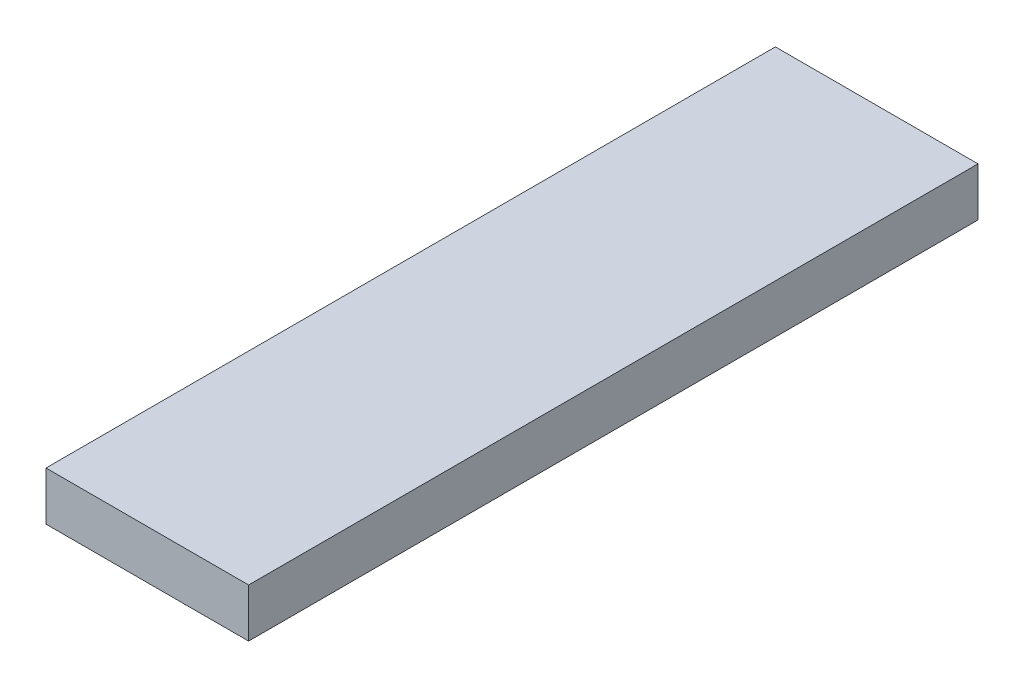
from build123d import *

# Parameters (mm, degrees)
ESBO_O1_W                = 25
ESBO_O1_H                = 90
RESSALTO_EXTRUS_O1_DEPTH = 6


with BuildPart() as part:
    # Esboço1 → Ressalto-extrusão1 (new body)
    with BuildSketch(Plane(origin=(0, 0, 0), x_dir=(1, 0, 0), z_dir=(0, 1, 0))):
        Rectangle(ESBO_O1_W, ESBO_O1_H)
    extrude(amount=RESSALTO_EXTRUS_O1_DEPTH)


solid = part.part
